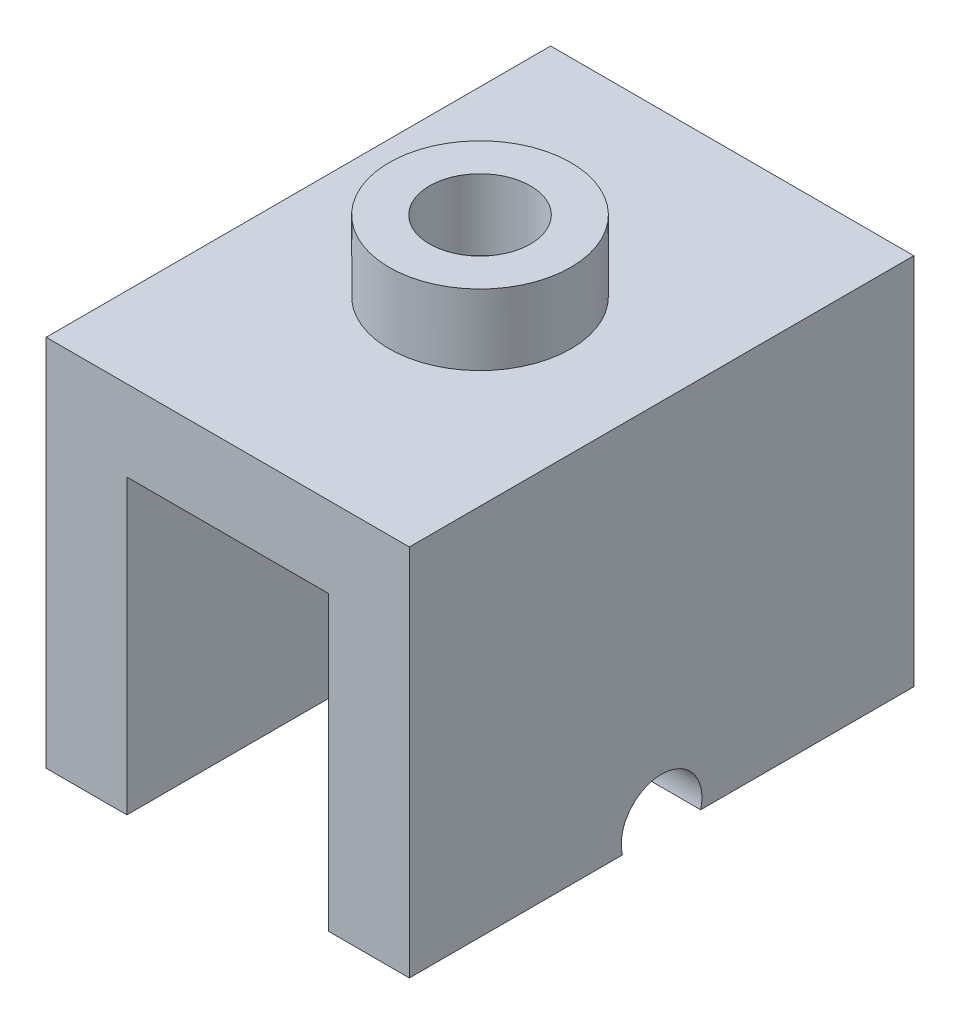
from build123d import *

# Parameters (mm, degrees)
BOSS_EXTRUDE1_DEPTH = 12.5
SKETCH2_R           = 4.5
SKETCH2_R_2         = 2.5
EXTRUDE_THIN1_DEPTH = 3.5
CUT_EXTRUDE1_REACH  = 30.679
SKETCH3_R           = 2


with BuildPart() as part:
    # Sketch1 → Boss-Extrude1 (new, symmetric)
    with BuildSketch(Plane.XY):
        Polygon((-9, 0), (9, 0), (9, -18.5), (5, -18.5), (5, -4), (-5, -4), (-5, -18.5), (-9, -18.5), align=None)
    extrude(amount=BOSS_EXTRUDE1_DEPTH, both=True)

    # Sketch2 → Extrude-Thin1 (add)
    with BuildSketch(Plane(origin=(0, 0, 0), x_dir=(1, 0, 0), z_dir=(0, 1, 0))):
        Circle(SKETCH2_R)
        Circle(SKETCH2_R_2, mode=Mode.SUBTRACT)
    extrude(amount=EXTRUDE_THIN1_DEPTH)

    # Cut-Extrude1: up to this face of the body (flat: up to its plane)
    cut_extrude1_end = Plane(part.part.faces().sort_by_distance((-9, -9.25, 0))[0])
    # Sketch3 → Cut-Extrude1 (cut, up to the picked face)
    with BuildSketch(Plane(origin=(9, 0, 0), x_dir=(0, 0, -1), z_dir=(1, 0, 0)), mode=Mode.PRIVATE) as cut_extrude1_sk1:
        with Locations((0, -18)):
            Circle(SKETCH3_R)
    cut_extrude1_tool1 = split(extrude(cut_extrude1_sk1.sketch, amount=-CUT_EXTRUDE1_REACH, mode=Mode.PRIVATE), bisect_by=cut_extrude1_end, keep=Keep.BOTH, mode=Mode.PRIVATE)
    add(cut_extrude1_tool1.solids().sort_by(Axis((9, -18, 0), (-1, 0, 0)))[0], mode=Mode.SUBTRACT)


solid = part.part
